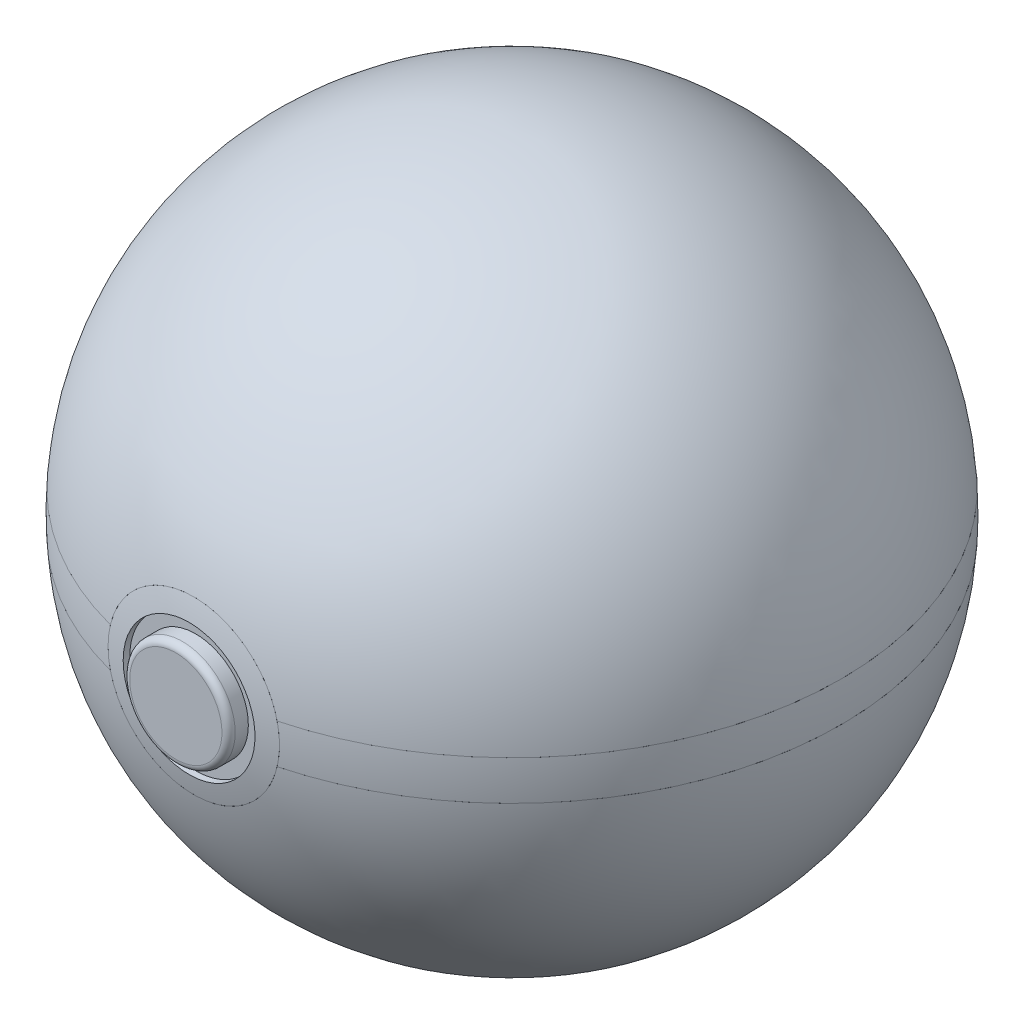
from build123d import *

# Parameters (mm, degrees)
SKETCH4_R                = 13
CUT_EXTRUDE1_DEPTH       = 70
BOSS_EXTRUDE2_REACH      = 88.603
BOSS_EXTRUDE2_END_RADIUS = 50
SKETCH5_R                = 13
SKETCH6_R                = 10
CUT_EXTRUDE2_DEPTH       = 70
SKETCH7_R                = 10
BOSS_EXTRUDE4_DEPTH      = 48
SKETCH8_R                = 8
BOSS_EXTRUDE6_DEPTH      = 3
FILLET1_R                = 1


with BuildPart() as part:
    # Sketch1 → Revolve1 (revolve)
    with BuildSketch(Plane.XY):
        with BuildLine():
            Line((49.909918854, 3), (0, 3))
            Line((0, 3), (0, 50))
            ThreePointArc((0, 50), (34.278273002, 36.400549446), (49.909918854, 3))
        make_face()
        with BuildLine():
            Line((49.909918854, -3), (0, -3))
            Line((0, -3), (0, -50))
            ThreePointArc((0, -50), (34.278273002, -36.400549446), (49.909918854, -3))
        make_face()
    revolve(axis=Axis((0, -3, 0), (0, 1, 0)))


with BuildPart() as body_2:
    # Sketch3 → Revolve2 (revolve)
    with BuildSketch(Plane.XY):
        with BuildLine():
            Line((49.909918854, 3), (0, 3))
            Line((0, 3), (0, -3))
            Line((0, -3), (49.909918854, -3))
            ThreePointArc((49.909918854, -3), (50, 0), (49.909918854, 3))
        make_face()
    revolve(axis=Axis((0, 3, 0), (0, -1, 0)))


with BuildPart() as cut_extrude1_tool:
    # Sketch4 → Cut-Extrude1 (new body)
    with BuildSketch(Plane.XY):
        Circle(SKETCH4_R)
    extrude(amount=CUT_EXTRUDE1_DEPTH)


with BuildPart() as part_1:
    add(part.part)

    # Cut-Extrude1: cut by cut_extrude1_tool
    add(cut_extrude1_tool.part, mode=Mode.SUBTRACT)


with BuildPart() as body_2_1:
    add(body_2.part)

    # Cut-Extrude1: cut by cut_extrude1_tool
    add(cut_extrude1_tool.part, mode=Mode.SUBTRACT)


with BuildPart() as body_3:
    # Boss-Extrude2: up to this sphere (the profile starts inside it)
    boss_extrude2_end = Location((0, 0, 0)) * Sphere(BOSS_EXTRUDE2_END_RADIUS, mode=Mode.PRIVATE)
    # Sketch5 → Boss-Extrude2 (new, up to the surface)
    with BuildSketch(Plane.XY, mode=Mode.PRIVATE) as boss_extrude2_sk1:
        with Locations(Location((0, 0, 0), (0, 0, 180))):
            Circle(SKETCH5_R)
    boss_extrude2_tool1 = extrude(boss_extrude2_sk1.sketch, amount=BOSS_EXTRUDE2_REACH, mode=Mode.PRIVATE) & boss_extrude2_end
    add(boss_extrude2_tool1.solids().sort_by_distance((0, 0, 0))[0])

    # Sketch6 → Cut-Extrude2 (cut)
    with BuildSketch(Plane.XY):
        with Locations(Location((0, 0, 0), (0, 0, 180))):
            Circle(SKETCH6_R)
    extrude(amount=CUT_EXTRUDE2_DEPTH, mode=Mode.SUBTRACT)


with BuildPart() as body_4:
    # Sketch7 → Boss-Extrude4 (new body)
    with BuildSketch(Plane.XY):
        Circle(SKETCH7_R)
    extrude(amount=BOSS_EXTRUDE4_DEPTH)


with BuildPart() as body_5:
    # Sketch8 → Boss-Extrude6 (new body)
    with BuildSketch(Plane.XY.offset(48)):
        Circle(SKETCH8_R)
    extrude(amount=BOSS_EXTRUDE6_DEPTH)

    # Fillet1
    fillet1_edges = [body_5.edges().sort_by_distance(p)[0] for p in [
        (-8, 0, 51),
    ]]
    fillet(fillet1_edges, radius=FILLET1_R)


solid = Compound([part_1.part, body_2_1.part, body_3.part, body_4.part, body_5.part])
